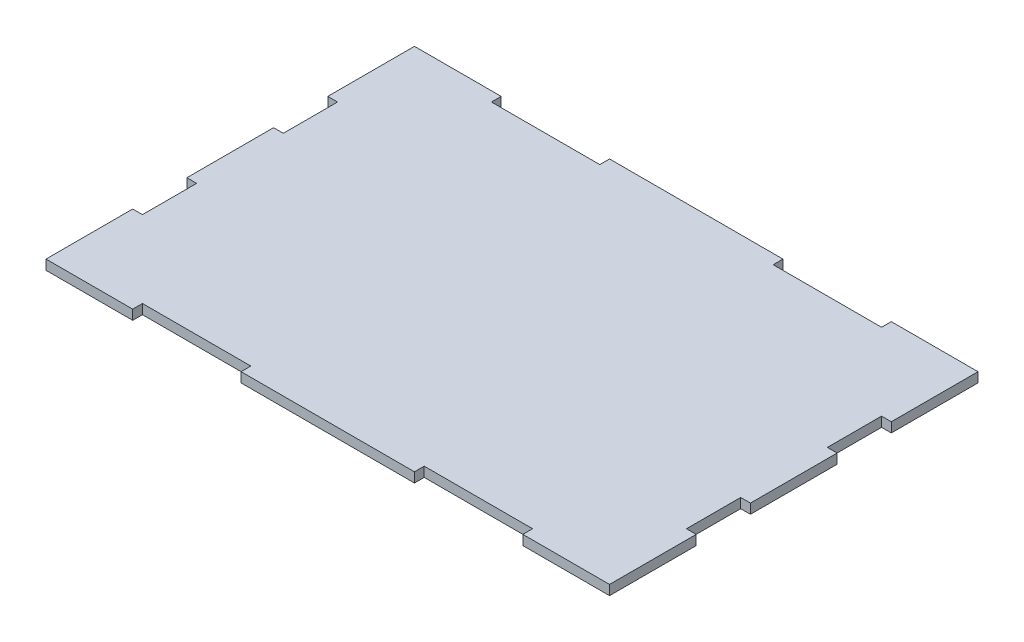
from build123d import *

# Parameters (mm, degrees)
BOSS_EXTRUDE1_DEPTH = 4.5


with BuildPart() as part:
    # Sketch1 → Boss-Extrude1 (new body)
    with BuildSketch(Plane(origin=(0, 0, 0), x_dir=(1, 0, 0), z_dir=(0, 1, 0))):
        Polygon((-12.298056156, 5.911003401), (27.701943844, 5.911003401), (27.701943844, 1.411003401), (77.701943844, 1.411003401), (77.701943844, 5.911003401), (157.701943844, 5.911003401), (157.701943844, 1.411003401), (207.701943844, 1.411003401), (207.701943844, 5.911003401), (247.701943844, 5.911003401), (247.701943844, -34.088996599), (243.201943844, -34.088996599), (243.201943844, -59.088996599), (247.701943844, -59.088996599), (247.701943844, -99.088996599), (243.201943844, -99.088996599), (243.201943844, -124.088996599), (247.701943844, -124.088996599), (247.701943844, -164.088996599), (207.701943844, -164.088996599), (207.701943844, -159.588996599), (157.701943844, -159.588996599), (157.701943844, -164.088996599), (77.701943844, -164.088996599), (77.701943844, -159.588996599), (27.701943844, -159.588996599), (27.701943844, -164.088996599), (-12.298056156, -164.088996599), (-12.298056156, -124.088996599), (-7.798056156, -124.088996599), (-7.798056156, -99.088996599), (-12.298056156, -99.088996599), (-12.298056156, -59.088996599), (-7.798056156, -59.088996599), (-7.798056156, -34.088996599), (-12.298056156, -34.088996599), align=None)
    extrude(amount=BOSS_EXTRUDE1_DEPTH)


solid = part.part
